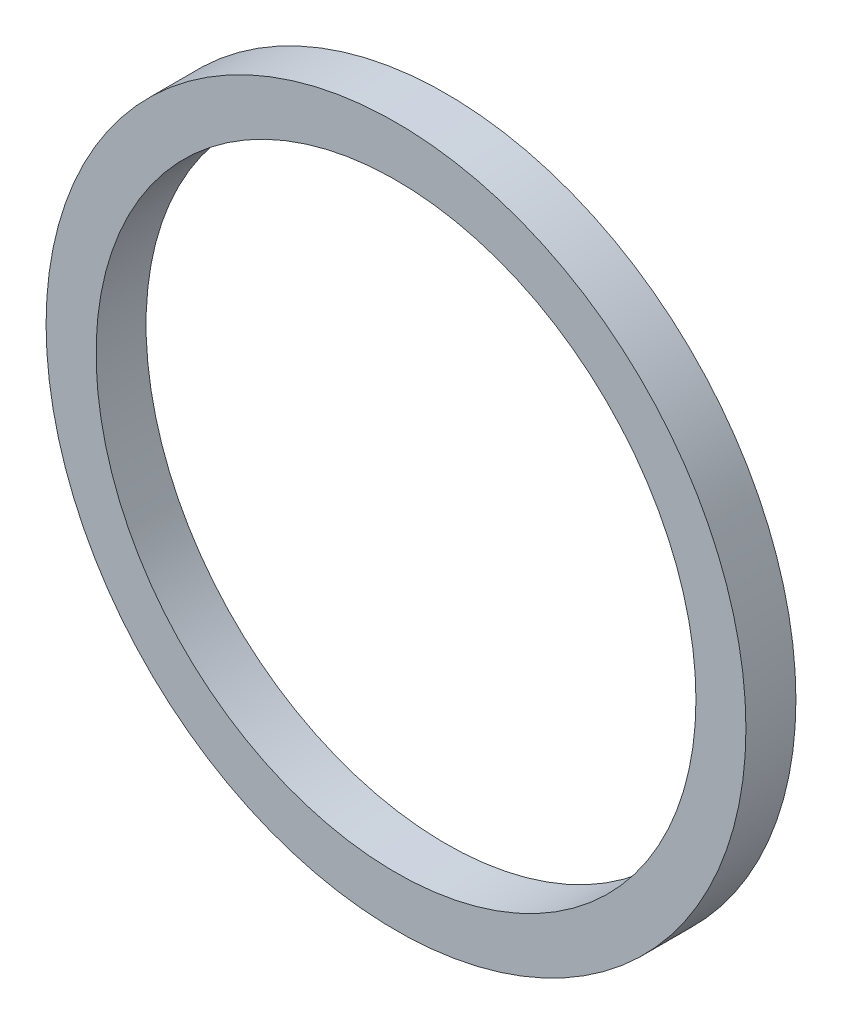
from build123d import *

# Parameters (mm, degrees)
SKETCH1_R           = 35
SKETCH1_R_2         = 30
BOSS_EXTRUDE1_DEPTH = 5


with BuildPart() as part:
    # Sketch1 → Boss-Extrude1 (new body)
    with BuildSketch(Plane.XY):
        Circle(SKETCH1_R)
        Circle(SKETCH1_R_2, mode=Mode.SUBTRACT)
    extrude(amount=BOSS_EXTRUDE1_DEPTH)


solid = part.part
